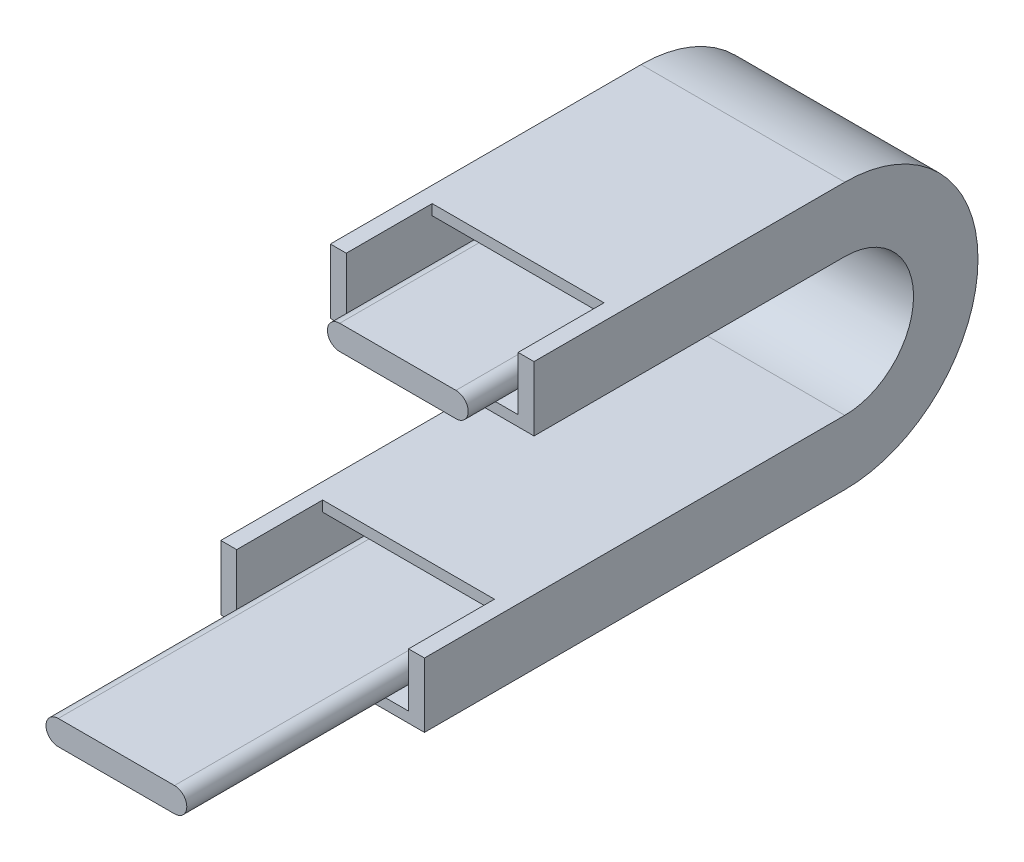
from build123d import *

# Parameters (mm, degrees)
SKETCH2_W          = 47.4
SKETCH2_H          = 15
SKETCH2_W_2        = 40
SKETCH2_H_2        = 10.1
SKETCH26_W         = 22
SKETCH26_H         = 15
EXTRUDE7_DEPTH     = 47.4
SKETCH29_W         = 40
SKETCH29_H         = 10.1
CUT_EXTRUDE1_REACH = 127.776
SKETCH35_W         = 40
SKETCH35_H         = 20
CUT_EXTRUDE2_REACH = 121.099
SKETCH36_W         = 40
SKETCH36_H         = 20
EXTRUDE4_DEPTH     = 70
EXTRUDE8_DEPTH     = 30


with BuildPart() as part:
    # Sweep1: sweep along a path in Sketch15
    with BuildLine(Plane(origin=(0, 0, 0), x_dir=(0, 0, -1), z_dir=(1, 0, 0))) as sweep1_path:
        Line((0, 0), (75.83628632, 0))
        ThreePointArc((75.83628632, 0), (99.33628632, 23.5), (75.83628632, 47))
        Line((75.83628632, 47), (25.5, 47))
    # Sketch2 → Sweep1 (sweep)
    with BuildSketch(Plane.XY):
        Rectangle(SKETCH2_W, SKETCH2_H)
        Rectangle(SKETCH2_W_2, SKETCH2_H_2, mode=Mode.SUBTRACT)
    sweep(path=sweep1_path.line)

    # Sketch26 → Extrude7 (add)
    with BuildSketch(Plane(origin=(23.7, 0, 0), x_dir=(0, 0, -1), z_dir=(1, 0, 0))):
        with Locations((14.5, 47)):
            Rectangle(SKETCH26_W, SKETCH26_H)
        with Locations((-11, 0)):
            Rectangle(SKETCH26_W, SKETCH26_H)
    extrude(amount=-EXTRUDE7_DEPTH)

    # Cut-Sweep2: sweep along a path in Sketch30
    with BuildLine(Plane(origin=(0, 0, 0), x_dir=(0, 0, -1), z_dir=(1, 0, 0))) as cut_sweep2_path:
        Line((-22, 0), (75.83628632, 0))
        ThreePointArc((75.83628632, 0), (99.33628632, 23.5), (75.83628632, 47))
        Line((75.83628632, 47), (3.5, 47))
    # Sketch29 → Cut-Sweep2 (sweep, cut)
    with BuildSketch(Plane.XY.offset(22)):
        Rectangle(SKETCH29_W, SKETCH29_H)
    sweep(path=cut_sweep2_path.line, mode=Mode.SUBTRACT)

    # Sketch35 → Cut-Extrude1 (cut, up to next)
    with BuildSketch(Plane(origin=(0, 54.5, 0), x_dir=(1, 0, 0), z_dir=(0, 1, 0)), mode=Mode.PRIVATE) as cut_extrude1_sk1:
        with Locations((0, 13.5)):
            Rectangle(SKETCH35_W, SKETCH35_H)
    cut_extrude1_tool1 = extrude(cut_extrude1_sk1.sketch, amount=-CUT_EXTRUDE1_REACH, mode=Mode.PRIVATE) & part.part
    add(cut_extrude1_tool1.solids().sort_by_distance((0, 54.5, -13.5))[0], mode=Mode.SUBTRACT)

    # Sketch36 → Cut-Extrude2 (cut, up to next)
    with BuildSketch(Plane(origin=(0, 7.5, 0), x_dir=(1, 0, 0), z_dir=(0, 1, 0)), mode=Mode.PRIVATE) as cut_extrude2_sk1:
        with Locations((0, -12)):
            Rectangle(SKETCH36_W, SKETCH36_H)
    cut_extrude2_tool1 = extrude(cut_extrude2_sk1.sketch, amount=-CUT_EXTRUDE2_REACH, mode=Mode.PRIVATE) & part.part
    add(cut_extrude2_tool1.solids().sort_by_distance((0, 7.5, 12))[0], mode=Mode.SUBTRACT)


with BuildPart() as body_2:
    # Sweep2: sweep along a path in Sketch34
    with BuildLine(Plane(origin=(0, 0, 0), x_dir=(0, 0, -1), z_dir=(1, 0, 0))) as sweep2_path:
        Line((0, -2.1925), (75.83628632, -2.1925))
        ThreePointArc((75.83628632, -2.1925), (99.33628632, 21.3075), (75.83628632, 44.8075))
        Line((75.83628632, 44.8075), (25.5, 44.8075))
    # Sketch1 → Sweep2 (sweep)
    with BuildSketch(Plane.XY):
        with BuildLine():
            Line((-13.5255, 0.715), (13.5255, 0.715))
            ThreePointArc((13.5255, 0.715), (16.383, -2.1425), (13.5255, -5))
            Line((13.5255, -5), (-13.5255, -5))
            ThreePointArc((-13.5255, -5), (-16.383, -2.1425), (-13.5255, 0.715))
        make_face()
    sweep(path=sweep2_path.line)

    # Sketch25 → Extrude4 (add)
    with BuildSketch(Plane.XY):
        with BuildLine():
            Line((13.5255, 0.715), (-13.5255, 0.715))
            ThreePointArc((-13.5255, 0.715), (-16.383, -2.1425), (-13.5255, -5))
            Line((-13.5255, -5), (13.5255, -5))
            ThreePointArc((13.5255, -5), (16.383, -2.1425), (13.5255, 0.715))
        make_face()
    extrude(amount=EXTRUDE4_DEPTH)

    # Sketch31 → Extrude8 (add)
    with BuildSketch(Plane.XY.offset(-25.5)):
        with BuildLine():
            Line((-13.5255, 41.9), (13.5255, 41.9))
            ThreePointArc((13.5255, 41.9), (16.383, 44.7575), (13.5255, 47.615))
            Line((13.5255, 47.615), (-13.5255, 47.615))
            ThreePointArc((-13.5255, 47.615), (-16.383, 44.7575), (-13.5255, 41.9))
        make_face()
    extrude(amount=EXTRUDE8_DEPTH)


solid = Compound([part.part, body_2.part])
